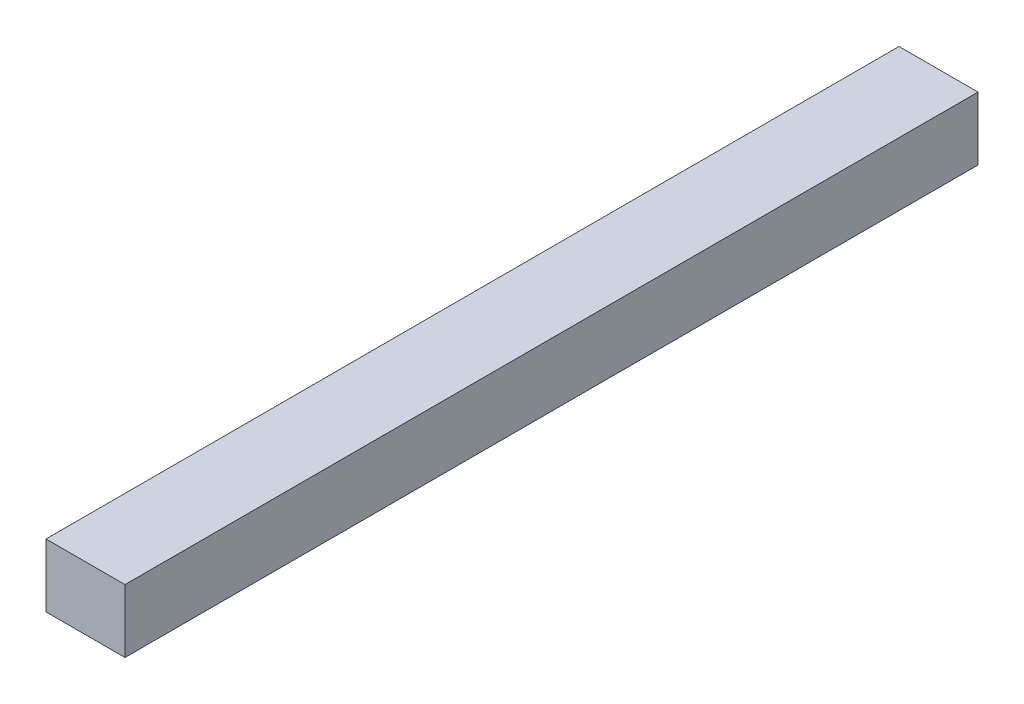
from build123d import *

# Parameters (mm, degrees)
ESQUISSE1_W        = 50
ESQUISSE1_H        = 40
BOSS_EXTRU_1_DEPTH = 540


with BuildPart() as part:
    # Esquisse1 → Boss.-Extru.1 (new body)
    with BuildSketch(Plane.XY):
        with Locations((25, 20)):
            Rectangle(ESQUISSE1_W, ESQUISSE1_H)
    extrude(amount=BOSS_EXTRU_1_DEPTH)


solid = part.part
